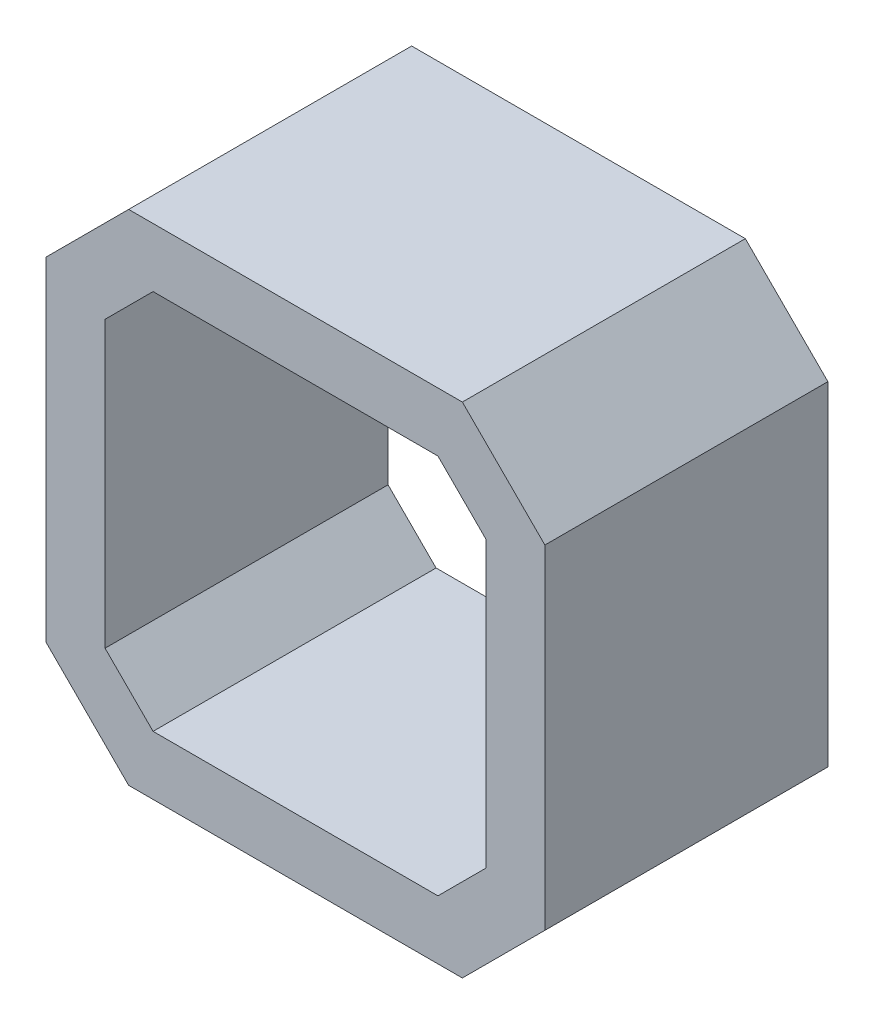
from build123d import *

# Parameters (mm, degrees)
RESSALTO_EXTRUS_O2_DEPTH = 24


with BuildPart() as part:
    # Esboço1 → Ressalto-extrusão2 (new body)
    with BuildSketch(Plane.XY):
        Polygon((-14.15, 21.15), (-21.15, 14.15), (-21.15, -14.15), (-14.15, -21.15), (14.15, -21.15), (21.15, -14.15), (21.15, 14.15), (14.15, 21.15), align=None)
        Polygon((12.078932188, 16.15), (-12.078932188, 16.15), (-16.15, 12.078932188), (-16.15, -12.078932188), (-12.078932188, -16.15), (12.078932188, -16.15), (16.15, -12.078932188), (16.15, 12.078932188), align=None, mode=Mode.SUBTRACT)
    extrude(amount=RESSALTO_EXTRUS_O2_DEPTH)


solid = part.part
